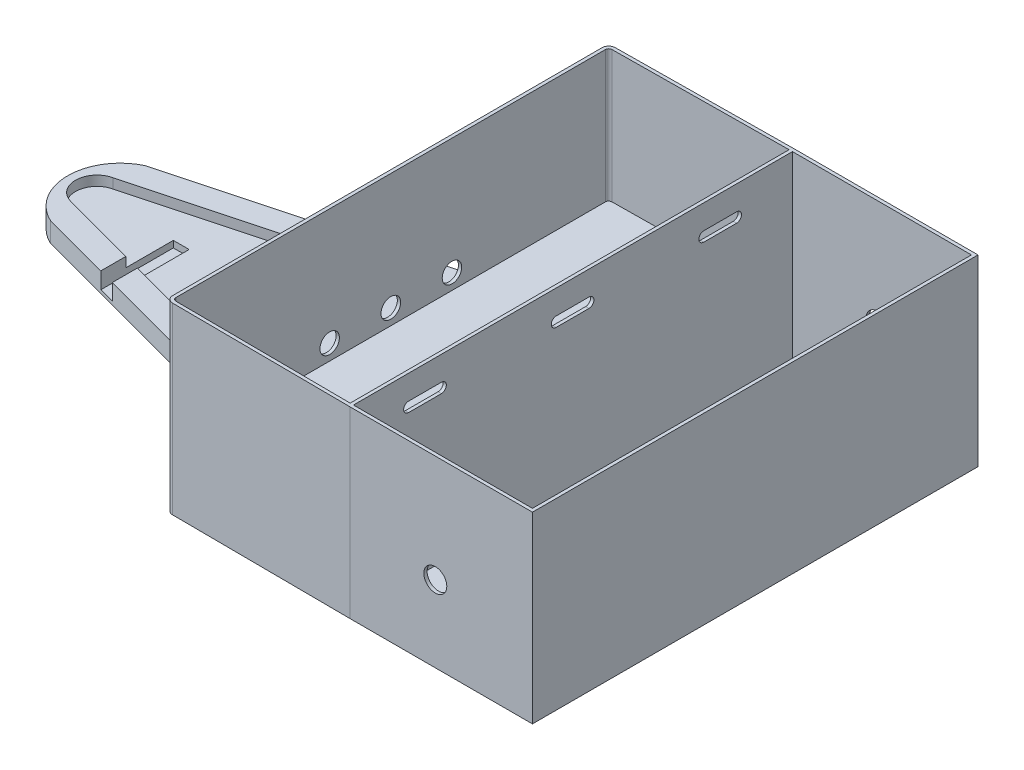
from build123d import *

# Parameters (mm, degrees)
BOSS_EXTRUDE1_DEPTH      = 3
BOSS_EXTRUDE2_DEPTH      = 6
BOSS_EXTRUDE3_DEPTH      = 9.69
BOSS_EXTRUDE3_DEPTH_BACK = 6
FILLET1_R                = 2
FILLET2_R                = 2
BOSS_EXTRUDE4_DEPTH      = 40.233333333
CUT_EXTRUDE1_DEPTH       = 1.5
CUT_EXTRUDE2_DEPTH       = 1.5
BOSS_EXTRUDE5_DEPTH      = 54.58
CUT_EXTRUDE3_DEPTH       = 214.009386465
CUT_EXTRUDE3_DEPTH_BACK  = 214.009386465
SKETCH10_R               = 3.5
SKETCH12_W               = 12
SKETCH12_H               = 30.726270376
SKETCH12_W_2             = 4.828508562
SKETCH12_H_2             = 30.231621193
CUT_EXTRUDE4_DEPTH       = 5
SKETCH13_W               = 135.857143104
SKETCH13_H               = 55.923333333
BOSS_EXTRUDE6_DEPTH      = 1


with BuildPart() as part:
    # Sketch2 → Boss-Extrude1 (new body)
    with BuildSketch(Plane(origin=(0, 0, 0), x_dir=(1, 0, 0), z_dir=(0, 1, 0))):
        with BuildLine():
            Line((-44.358814779, -15.844661539), (100.530059165, -54.667518304))
            Line((100.530059165, -54.667518304), (100.530059165, 51.906312945))
            Line((100.530059165, 51.906312945), (-44.358814779, 13.083456179))
            ThreePointArc((-44.358814779, 13.083456179), (-53.518419956, -1.38060268), (-44.358814779, -15.844661539))
        make_face()
    extrude(amount=BOSS_EXTRUDE1_DEPTH)

    # Sketch2<3> → Boss-Extrude2 (add)
    with BuildSketch(Plane(origin=(0, 0, 0), x_dir=(1, 0, 0), z_dir=(0, 1, 0))):
        with BuildLine():
            Line((-44.358814779, 13.083456179), (100.530059165, 51.906312945))
            Line((100.530059165, 51.906312945), (100.530059165, -54.667518304))
            Line((100.530059165, -54.667518304), (-44.358814779, -15.844661539))
            ThreePointArc((-44.358814779, -15.844661539), (-53.518419956, -1.38060268), (-44.358814779, 13.083456179))
        make_face()
        with BuildLine():
            Line((-46.067020476, 4.994507774), (35.007341865, 26.71831769))
            ThreePointArc((35.007341865, 26.71831769), (38.656739262, -1.38060268), (35.007341865, -29.479523049))
            Line((35.007341865, -29.479523049), (-46.067020476, -7.755713133))
            ThreePointArc((-46.067020476, -7.755713133), (-51.145215007, -1.38060268), (-46.067020476, 4.994507774))
        make_face(mode=Mode.SUBTRACT)
    extrude(amount=BOSS_EXTRUDE2_DEPTH)

    # Sketch3 → Boss-Extrude3 (add, two sides: drawn at the far end of the back side and taken through both)
    with BuildSketch(Plane(origin=(0, 6, 0), x_dir=(1, 0, 0), z_dir=(0, 1, 0)).offset(-BOSS_EXTRUDE3_DEPTH_BACK)):
        with BuildLine():
            Line((44.072517202, -66.967163029), (44.072517202, -39.539765529))
            Line((44.072517202, -39.539765529), (44.072517202, 36.778560169))
            Line((44.072517202, 36.778560169), (44.072517202, 63.981792798))
            ThreePointArc((44.072517202, 63.981792798), (44.650972897, 65.388637419), (46.051728991, 65.981684758))
            Line((46.051728991, 65.981684758), (100.530059165, 66.547968872))
            Line((100.530059165, 66.547968872), (100.530059165, 51.906312945))
            Line((100.530059165, 51.906312945), (100.530059165, -54.667518304))
            Line((100.530059165, -54.667518304), (100.530059165, -69.309174232))
            Line((100.530059165, -69.309174232), (46.059958243, -68.967123596))
            ThreePointArc((46.059958243, -68.967123596), (44.653870326, -68.376929336), (44.072517202, -66.967163029))
        make_face()
    extrude(amount=BOSS_EXTRUDE3_DEPTH + BOSS_EXTRUDE3_DEPTH_BACK)

    # Fillet1
    fillet1_edges = [part.edges().sort_by_distance(p)[0] for p in [
        (44.072517202, 3, 39.539765529),
    ]]
    fillet(fillet1_edges, radius=FILLET1_R)

    # Fillet2
    fillet2_edges = [part.edges().sort_by_distance(p)[0] for p in [
        (44.072517202, 3, -36.778560169),
    ]]
    fillet(fillet2_edges, radius=FILLET2_R)

    # Sketch5 → Boss-Extrude4 (add)
    with BuildSketch(Plane(origin=(0, 15.69, 0), x_dir=(1, 0, 0), z_dir=(0, 1, 0))):
        with BuildLine():
            Line((46.059958243, -68.967123596), (100.530059165, -69.309174232))
            Line((100.530059165, -69.309174232), (100.530059165, 66.547968872))
            Line((100.530059165, 66.547968872), (46.051728991, 65.981684758))
            ThreePointArc((46.051728991, 65.981684758), (44.650972897, 65.388637419), (44.072517202, 63.981792798))
            Line((44.072517202, 63.981792798), (44.072517202, -66.967163029))
            ThreePointArc((44.072517202, -66.967163029), (44.653870326, -68.376929336), (46.059958243, -68.967123596))
        make_face()
        with BuildLine():
            Line((99.530059165, -68.302874912), (99.530059165, 65.537520182))
            Line((99.530059165, 65.537520182), (46.062123097, 64.981738778))
            ThreePointArc((46.062123097, 64.981738778), (45.36174505, 64.685215109), (45.072517202, 63.981792798))
            Line((45.072517202, 63.981792798), (45.072517202, -66.967163029))
            ThreePointArc((45.072517202, -66.967163029), (45.363193764, -67.672046182), (46.066237723, -67.967143312))
            Line((46.066237723, -67.967143312), (99.530059165, -68.302874912))
        make_face(mode=Mode.SUBTRACT)
    extrude(amount=BOSS_EXTRUDE4_DEPTH)

    # Sketch6 → Cut-Extrude1 (cut)
    with BuildSketch(Plane.ZY.offset(-44.072517202)):
        with BuildLine():
            add(Edge.make_bspline(
                [(-15.745078449, 23.050825441), (-16.426574269, 23.424993836), (-18.107694271, 23.59390395), (-20.06054673, 21.997763181), (-20.359072413, 19.493331011), (-18.791777494, 17.501685815), (-16.270097491, 17.248320643), (-14.317245033, 18.844461412), (-14.018719349, 21.348893583), (-15.063582628, 22.676657046), (-15.745078449, 23.050825441)],
                knots=[0, 0, 0, 0, 0.785398163, 1.570796327, 2.35619449, 3.141592654, 3.926990817, 4.71238898, 5.497787144, 6.283185307, 6.283185307, 6.283185307, 6.283185307], degree=3))
        make_face()
        with BuildLine():
            add(Edge.make_bspline(
                [(4.422895342, 20.879911755), (4.30327296, 21.652897904), (3.419826029, 23.099177602), (0.951461151, 23.695508582), (-1.221188854, 22.380963882), (-1.828624955, 19.912466539), (-0.50345456, 17.743046992), (1.964910319, 17.146716012), (4.137560324, 18.461260712), (4.542517725, 20.106925607), (4.422895342, 20.879911755)],
                knots=[0, 0, 0, 0, 0.785398163, 1.570796327, 2.35619449, 3.141592654, 3.926990817, 4.71238898, 5.497787144, 6.283185307, 6.283185307, 6.283185307, 6.283185307], degree=3))
        make_face()
        with BuildLine():
            add(Edge.make_bspline(
                [(20.102815045, 23.421112297), (19.325002738, 23.421112297), (17.769378124, 22.760793636), (16.823992487, 20.421112297), (17.769378124, 18.081430957), (20.102815045, 17.090952967), (22.436251966, 18.081430957), (23.381637603, 20.421112297), (22.436251966, 22.760793636), (20.880627352, 23.421112297), (20.102815045, 23.421112297)],
                knots=[0, 0, 0, 0, 0.785398163, 1.570796327, 2.35619449, 3.141592654, 3.926990817, 4.71238898, 5.497787144, 6.283185307, 6.283185307, 6.283185307, 6.283185307], degree=3))
        make_face()
    extrude(amount=-CUT_EXTRUDE1_DEPTH, mode=Mode.SUBTRACT)

    # Sketch7 → Cut-Extrude2 (cut)
    with BuildSketch(Plane(origin=(100.530059165, 0, 0), x_dir=(0, 0, -1), z_dir=(1, 0, 0))):
        with BuildLine():
            Line((-51.487685115, 48.534557921), (-41.492685115, 48.534557921))
            ThreePointArc((-41.492685115, 48.534557921), (-39.98663504, 47.028507846), (-41.492685115, 45.522457772))
            Line((-41.492685115, 45.522457772), (-51.487685115, 45.522457772))
            ThreePointArc((-51.487685115, 45.522457772), (-52.99373519, 47.028507846), (-51.487685115, 48.534557921))
        make_face()
        with BuildLine():
            Line((-6.487685115, 48.534557921), (3.507314885, 48.534557921))
            ThreePointArc((3.507314885, 48.534557921), (5.013364959, 47.028507846), (3.507314885, 45.522457772))
            Line((3.507314885, 45.522457772), (-6.487685115, 45.522457772))
            ThreePointArc((-6.487685115, 45.522457772), (-7.99373519, 47.028507846), (-6.487685115, 48.534557921))
        make_face()
        with BuildLine():
            Line((38.512314885, 48.534557921), (48.507314885, 48.534557921))
            ThreePointArc((48.507314885, 48.534557921), (50.01336496, 47.028507846), (48.507314885, 45.522457772))
            Line((48.507314885, 45.522457772), (38.512314885, 45.522457772))
            ThreePointArc((38.512314885, 45.522457772), (37.00626481, 47.028507846), (38.512314885, 48.534557921))
        make_face()
    extrude(amount=-CUT_EXTRUDE2_DEPTH, mode=Mode.SUBTRACT)

    # Sketch8 → Boss-Extrude5 (add)
    with BuildSketch(Plane(origin=(100.530059165, 0, 0), x_dir=(0, 0, -1), z_dir=(1, 0, 0))):
        Polygon((66.547968872, 55.923333333), (66.547968872, 0), (-69.309174232, 0), (-69.309174232, 55.923333333), (-68.309174232, 55.923333333), (-68.309174232, 1), (65.547968872, 1), (65.547968872, 55.923333333), align=None)
    extrude(amount=BOSS_EXTRUDE5_DEPTH)

    # Sketch10 → Cut-Extrude3 (cut, two sides: drawn at the far end of the back side and taken through both)
    with BuildSketch(Plane.XY.offset(-65.547968872).offset(-CUT_EXTRUDE3_DEPTH_BACK)):
        with Locations((126.491326957, 23.246690768)):
            Circle(SKETCH10_R)
    extrude(amount=CUT_EXTRUDE3_DEPTH + CUT_EXTRUDE3_DEPTH_BACK, mode=Mode.SUBTRACT)

    # Sketch12 → Cut-Extrude4 (cut)
    with BuildSketch(Plane(origin=(0, 6, 0), x_dir=(1, 0, 0), z_dir=(0, 1, 0))):
        with Locations((13.982227259, -26.342654968)):
            Rectangle(SKETCH12_W, SKETCH12_H)
        with Locations((-20.920113411, -14.480437774)):
            Rectangle(SKETCH12_W_2, SKETCH12_H_2)
    extrude(amount=-CUT_EXTRUDE4_DEPTH, mode=Mode.SUBTRACT)

    # Sketch13 → Boss-Extrude6 (add)
    with BuildSketch(Plane(origin=(155.110059165, 0, 0), x_dir=(0, 0, -1), z_dir=(1, 0, 0))):
        with Locations((-1.38060268, 27.961666667)):
            Rectangle(SKETCH13_W, SKETCH13_H)
    extrude(amount=BOSS_EXTRUDE6_DEPTH)


solid = part.part
